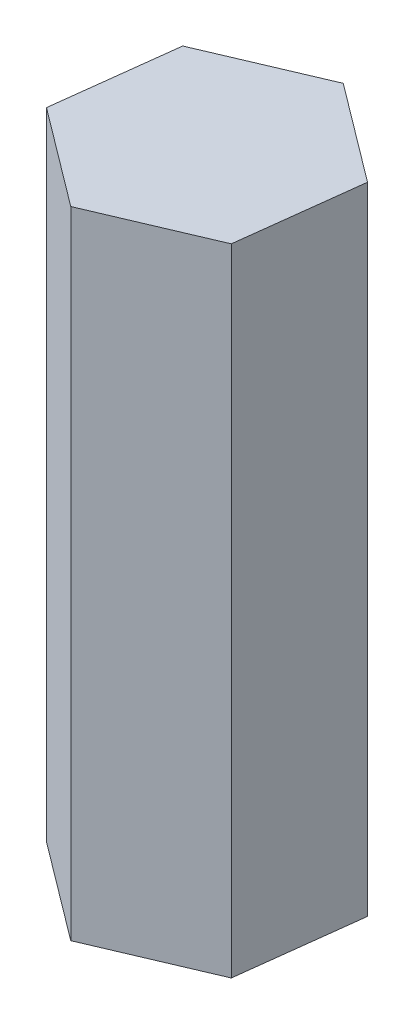
from build123d import *

# Parameters (mm, degrees)
BOSS_EXTRUDE1_DEPTH = 15


with BuildPart() as part:
    # Sketch1 → Boss-Extrude1 (new body)
    with BuildSketch(Plane(origin=(0, 0, 0), x_dir=(1, 0, 0), z_dir=(0, 1, 0))):
        Polygon((2.307490026, -1.734595951), (2.655949172, 1.131047006), (0.348459146, 2.865642957), (-2.307490026, 1.734595951), (-2.655949172, -1.131047006), (-0.348459146, -2.865642957), align=None)
    extrude(amount=BOSS_EXTRUDE1_DEPTH)


solid = part.part
